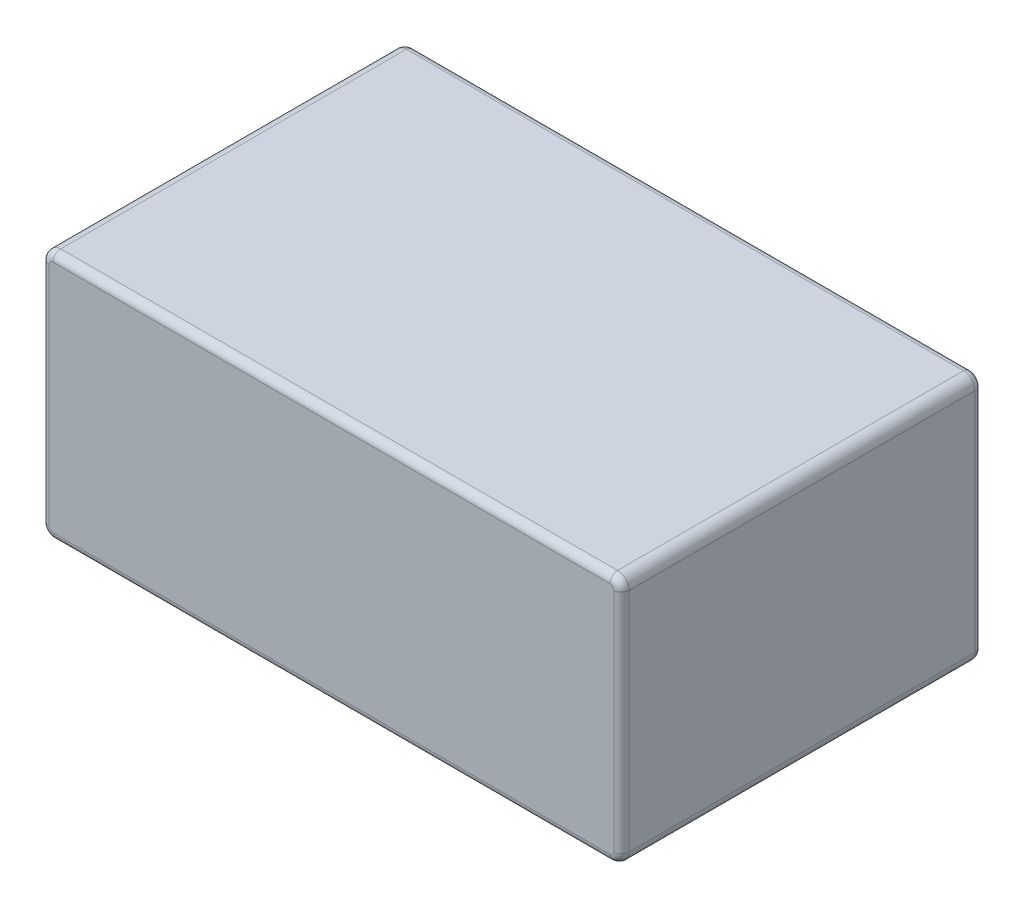
from build123d import *

# Parameters (mm, degrees)
BLOCK_START           = 323
BLOCK_1_DEPTH         = 94
BLOCK_EDGE_FILLET_1_R = 2


with BuildPart() as part:
    # Block sketch 1 → Block 1 (new body)
    with BuildSketch(Plane.XY.offset(BLOCK_START)):
        with BuildLine():
            Line((370, -112.5), (515, -112.5))
            ThreePointArc((515, -112.5), (517.121320344, -111.621320344), (518, -109.5))
            Line((518, -109.5), (518, -50.5))
            ThreePointArc((518, -50.5), (517.121320344, -48.378679656), (515, -47.5))
            Line((515, -47.5), (370, -47.5))
            ThreePointArc((370, -47.5), (367.878679656, -48.378679656), (367, -50.5))
            Line((367, -50.5), (367, -109.5))
            ThreePointArc((367, -109.5), (367.878679656, -111.621320344), (370, -112.5))
        make_face()
    extrude(amount=BLOCK_1_DEPTH)

    # Block edge fillet 1
    block_edge_fillet_1_edges = [part.edges().sort_by_distance(p)[0] for p in [
        (518, -80, 323),
        (517.121320344, -111.621320344, 323),
        (442.5, -112.5, 323),
        (367.878679656, -111.621320344, 323),
        (517.121320344, -111.621320344, 417),
        (518, -80, 417),
        (517.121320344, -48.378679656, 417),
        (442.5, -47.5, 417),
        (367.878679656, -48.378679656, 417),
        (367, -80, 417),
        (367.878679656, -111.621320344, 417),
        (367, -80, 323),
        (442.5, -112.5, 417),
        (367.878679656, -48.378679656, 323),
        (442.5, -47.5, 323),
        (517.121320344, -48.378679656, 323),
    ]]
    fillet(block_edge_fillet_1_edges, radius=BLOCK_EDGE_FILLET_1_R)


solid = part.part
